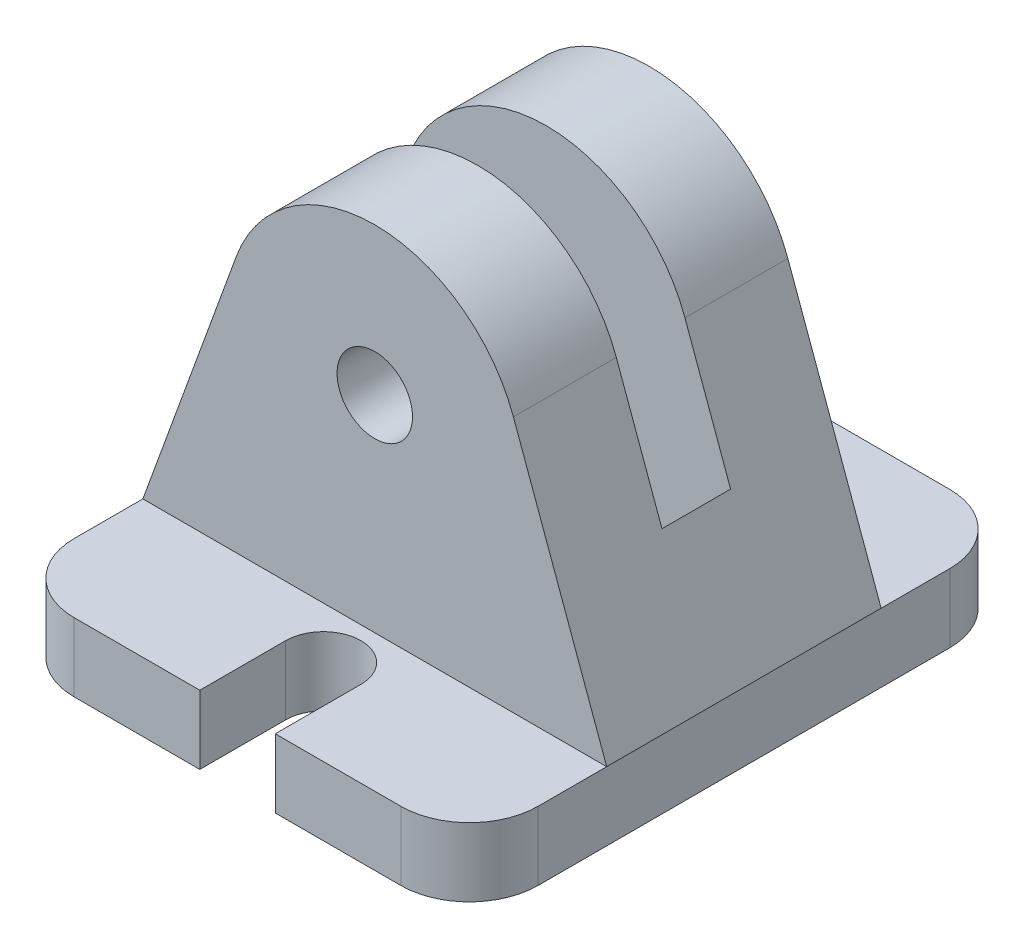
from build123d import *

# Parameters (mm, degrees)
SKETCH1_R           = 2.75
BOSS_EXTRUDE1_DEPTH = 10
SKETCH2_R           = 14.5
CUT_EXTRUDE1_DEPTH  = 2.5
BOSS_EXTRUDE2_DEPTH = 5
CUT_EXTRUDE5_DEPTH  = 41.387552571


with BuildPart() as part:
    # Sketch1 → Boss-Extrude1 (new, symmetric)
    with BuildSketch(Plane.XY):
        with BuildLine():
            Line((-10.101695673, 3.676716541), (-16.899464568, -15))
            Line((-16.899464568, -15), (16.899464568, -15))
            Line((16.899464568, -15), (10.101695673, 3.676716541))
            ThreePointArc((10.101695673, 3.676716541), (0, 10.75), (-10.101695673, 3.676716541))
        make_face()
        Circle(SKETCH1_R, mode=Mode.SUBTRACT)
    extrude(amount=BOSS_EXTRUDE1_DEPTH, both=True)

    # Sketch2 → Cut-Extrude1 (cut, symmetric)
    with BuildSketch(Plane.XY):
        Circle(SKETCH2_R)
    extrude(amount=CUT_EXTRUDE1_DEPTH, both=True, mode=Mode.SUBTRACT)

    # Sketch3 → Boss-Extrude2 (add)
    with BuildSketch(Plane.XZ.offset(15)):
        with BuildLine():
            Line((-16.899464568, 15), (-16.899464568, 10))
            Line((-16.899464568, 10), (16.899464568, 10))
            Line((16.899464568, 10), (16.899464568, 15))
            ThreePointArc((16.899464568, 15), (15.434998474, 18.535533906), (11.899464568, 20))
            Line((11.899464568, 20), (-11.899464568, 20))
            ThreePointArc((-11.899464568, 20), (-15.434998474, 18.535533906), (-16.899464568, 15))
        make_face()
        Polygon((16.899464568, 10), (-16.899464568, 10), (-16.899464568, -10), (16.899464568, -10), (16.899464568, 0), align=None)
        with BuildLine():
            Line((16.899464568, -10), (-16.899464568, -10))
            Line((-16.899464568, -10), (-16.899464568, -15))
            ThreePointArc((-16.899464568, -15), (-15.434998474, -18.535533906), (-11.899464568, -20))
            Line((-11.899464568, -20), (11.899464568, -20))
            ThreePointArc((11.899464568, -20), (15.434998474, -18.535533906), (16.899464568, -15))
            Line((16.899464568, -15), (16.899464568, -10))
        make_face()
    extrude(amount=BOSS_EXTRUDE2_DEPTH)

    # Sketch4 → Cut-Extrude5 (cut, through all)
    with BuildSketch(Plane.XZ.offset(20)):
        with BuildLine():
            Line((-2.75, 20), (-2.75, 13.75))
            ThreePointArc((-2.75, 13.75), (0, 11), (2.75, 13.75))
            Line((2.75, 13.75), (2.75, 20))
            Line((2.75, 20), (-2.75, 20))
        make_face()
        with BuildLine():
            Line((-2.75, -20), (-2.75, -13.75))
            ThreePointArc((-2.75, -13.75), (0, -11), (2.75, -13.75))
            Line((2.75, -13.75), (2.75, -20))
            Line((2.75, -20), (-2.75, -20))
        make_face()
    extrude(amount=-CUT_EXTRUDE5_DEPTH, mode=Mode.SUBTRACT)


solid = part.part
